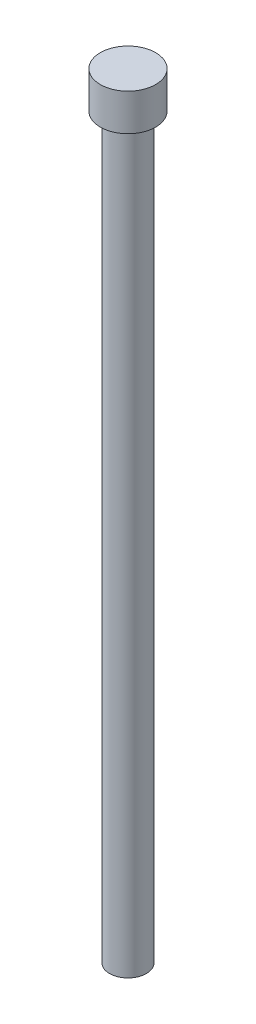
from build123d import *

# Parameters (mm, degrees)
SKETCH1_R           = 4.7625
BOSS_EXTRUDE1_DEPTH = 6.35
SKETCH2_R           = 3.175
BOSS_EXTRUDE2_DEPTH = 127


with BuildPart() as part:
    # Sketch1 → Boss-Extrude1 (new body)
    with BuildSketch(Plane(origin=(0, 0, 0), x_dir=(1, 0, 0), z_dir=(0, 1, 0))):
        with Locations(Location((0, 0, 0), (0, 0, 270))):
            Circle(SKETCH1_R)
    extrude(amount=BOSS_EXTRUDE1_DEPTH)

    # Sketch2 → Boss-Extrude2 (add)
    with BuildSketch(Plane.XZ):
        with Locations(Location((0, 0, 0), (0, 0, 270))):
            Circle(SKETCH2_R)
    extrude(amount=BOSS_EXTRUDE2_DEPTH)


solid = part.part
